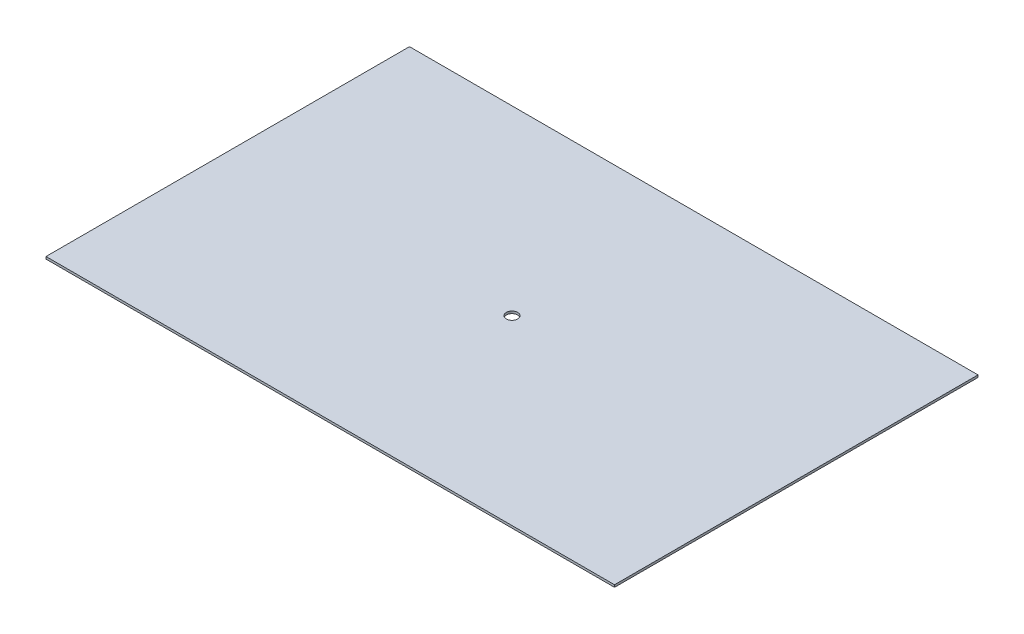
from build123d import *

# Parameters (mm, degrees)
SKETCH2_W           = 249.525
SKETCH2_H           = 159.525
SKETCH2_R           = 2.5
BOSS_EXTRUDE2_DEPTH = 1


with BuildPart() as part:
    # Sketch2 → Boss-Extrude2 (new body)
    with BuildSketch(Plane(origin=(0, 0, 0), x_dir=(1, 0, 0), z_dir=(0, 1, 0))):
        Rectangle(SKETCH2_W, SKETCH2_H)
        with Locations(Location((0, 0, 0), (0, 0, 270))):
            Circle(SKETCH2_R, mode=Mode.SUBTRACT)
    extrude(amount=BOSS_EXTRUDE2_DEPTH)


solid = part.part
